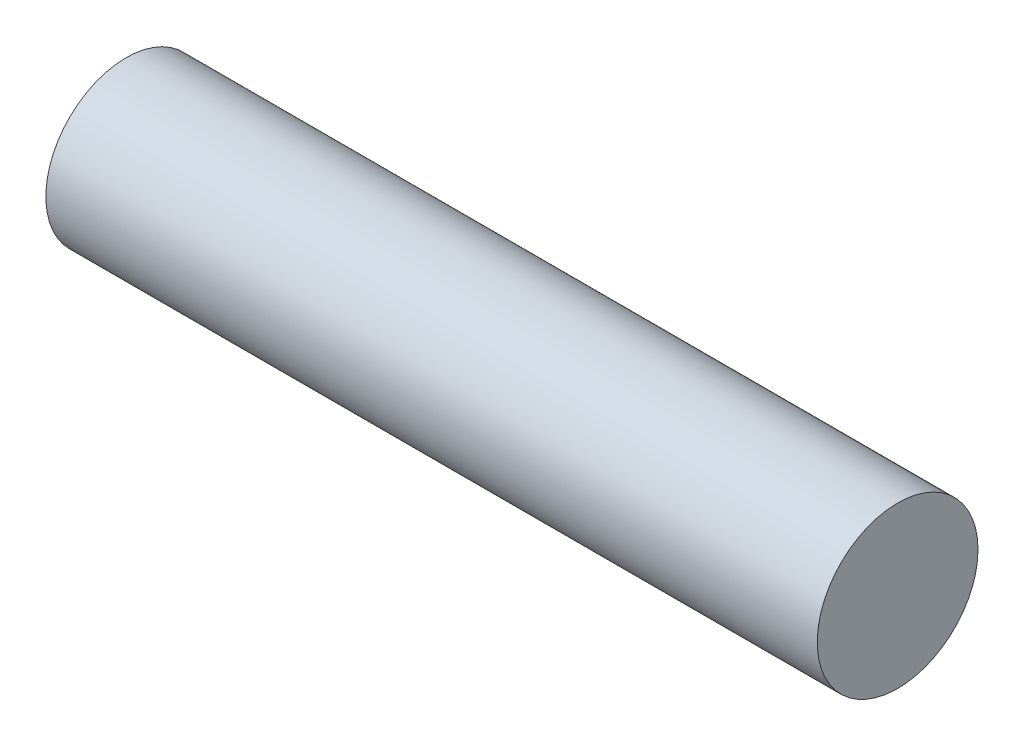
from build123d import *

# Parameters (mm, degrees)
SKETCH1_R           = 12.5
BOSS_EXTRUDE1_DEPTH = 60


with BuildPart() as part:
    # Sketch1 → Boss-Extrude1 (new, symmetric)
    with BuildSketch(Plane(origin=(0, 0, 0), x_dir=(0, 0, -1), z_dir=(1, 0, 0))):
        Circle(SKETCH1_R)
    extrude(amount=BOSS_EXTRUDE1_DEPTH, both=True)


solid = part.part
